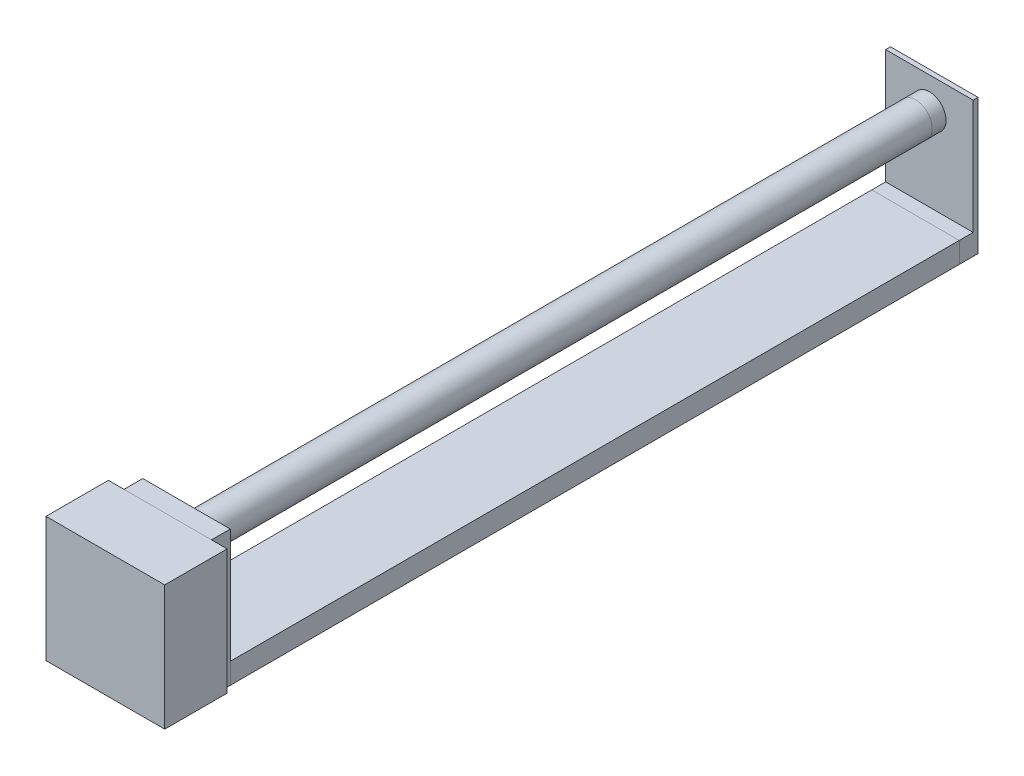
from build123d import *

# Parameters (mm, degrees)
SKETCH_1_W          = 42
SKETCH_1_H          = 10
EXTRUDE_1_DEPTH     = 350
SKETCH_2_W          = 42
SKETCH_2_H          = 65
EXTRUDE_2_DEPTH     = 9
SKETCH_3_W          = 42
SKETCH_3_H          = 65
EXTRUDE_3_DEPTH     = 9
SKETCH_4_R          = 8
EXTRUDE_4_DEPTH     = 350
SKETCH_5_W          = 57
SKETCH_5_H          = 60
EXTRUDE_5_DEPTH     = 56
SCALE_1_SCALE       = 0.3
SKETCH_6_W          = 12.6
SKETCH_6_H          = 16.5
SKETCH_6_R          = 2.4
CUT_EXTRUDE_1_DEPTH = 2
SKETCH_7_W          = 42.471504896
SKETCH_7_H          = 16.55668835
CUT_EXTRUDE_2_DEPTH = 30


with BuildPart() as part:
    # 草图1 → 凸台-拉伸1 (new body)
    with BuildSketch(Plane.XY):
        Rectangle(SKETCH_1_W, SKETCH_1_H)
    extrude(amount=EXTRUDE_1_DEPTH)


with BuildPart() as body_2:
    # 草图2 → 凸台-拉伸2 (new body)
    with BuildSketch(Plane(origin=(0, 0, 0), x_dir=(-1, 0, 0), z_dir=(0, 0, -1))):
        with Locations((0, 27.5)):
            Rectangle(SKETCH_2_W, SKETCH_2_H)
    extrude(amount=EXTRUDE_2_DEPTH)


with BuildPart() as body_3:
    # 草图3 → 凸台-拉伸3 (new body)
    with BuildSketch(Plane.XY.offset(350)):
        with Locations((0, 27.5)):
            Rectangle(SKETCH_3_W, SKETCH_3_H)
    extrude(amount=EXTRUDE_3_DEPTH)


with BuildPart() as body_4:
    # 草图4 → 凸台-拉伸4 (new body)
    with BuildSketch(Plane.XY):
        with Locations(Location((0, 45, 0), (0, 0, 180))):
            Circle(SKETCH_4_R)
    extrude(amount=EXTRUDE_4_DEPTH)


with BuildPart() as body_5:
    # 草图5 → 凸台-拉伸5 (new body)
    with BuildSketch(Plane.XY.offset(359)):
        with Locations((0, 30)):
            Rectangle(SKETCH_5_W, SKETCH_5_H)
    extrude(amount=EXTRUDE_5_DEPTH)


with BuildPart() as part_1:
    # 缩放比例1: scaled about (0, 0, 0)
    add(part.part.scale(SCALE_1_SCALE))


with BuildPart() as body_4_1:
    # 缩放比例1: scaled about (0, 0, 0)
    add(body_4.part.scale(SCALE_1_SCALE))


with BuildPart() as body_5_1:
    # 缩放比例1: scaled about (0, 0, 0)
    add(body_5.part.scale(SCALE_1_SCALE))

    # 草图7 → 切除-拉伸2 (cut)
    with BuildSketch(Plane(origin=(0, 18, 0), x_dir=(1, 0, 0), z_dir=(0, 1, 0))):
        with Locations((2.069586044, -124.967185352)):
            Rectangle(SKETCH_7_W, SKETCH_7_H)
    extrude(amount=-CUT_EXTRUDE_2_DEPTH, mode=Mode.SUBTRACT)


with BuildPart() as body_2_1:
    # 缩放比例1: scaled about (0, 0, 0)
    add(body_2.part.scale(SCALE_1_SCALE))

    # 草图6 → 切除-拉伸1 (cut)
    with BuildSketch(Plane.XY):
        with Locations((0, 9.75)):
            Rectangle(SKETCH_6_W, SKETCH_6_H)
        with Locations((0, 13.5)):
            Circle(SKETCH_6_R, mode=Mode.SUBTRACT)
    extrude(amount=-CUT_EXTRUDE_1_DEPTH, mode=Mode.SUBTRACT)


with BuildPart() as body_3_1:
    # 缩放比例1: scaled about (0, 0, 0)
    add(body_3.part.scale(SCALE_1_SCALE))


solid = Compound([part_1.part, body_4_1.part, body_5_1.part, body_2_1.part, body_3_1.part])
